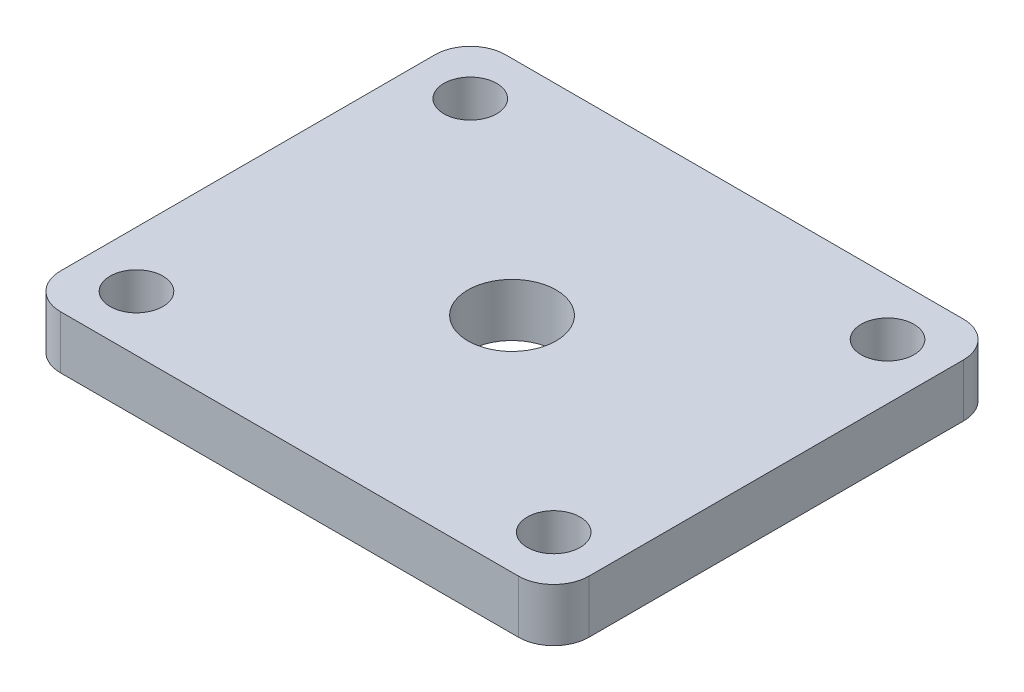
from build123d import *

# Parameters (mm, degrees)
SKETCH2_W           = 38
SKETCH2_H           = 32
SKETCH2_R           = 3.175
SKETCH2_R_2         = 1.89865
BOSS_EXTRUDE1_DEPTH = 3.81
FILLET1_R           = 2.54


with BuildPart() as part:
    # Sketch2 → Boss-Extrude1 (new body)
    with BuildSketch(Plane(origin=(0, 0, 0), x_dir=(1, 0, 0), z_dir=(0, 1, 0))):
        with Locations((19, 16)):
            Rectangle(SKETCH2_W, SKETCH2_H)
        with Locations(Location((19, 16, 0), (0, 0, 90))):
            Circle(SKETCH2_R, mode=Mode.SUBTRACT)
        with Locations(Location((4, 4, 0), (0, 0, 90))):
            Circle(SKETCH2_R_2, mode=Mode.SUBTRACT)
        with Locations(Location((4, 28, 0), (0, 0, 90))):
            Circle(SKETCH2_R_2, mode=Mode.SUBTRACT)
        with Locations(Location((34, 28, 0), (0, 0, 90))):
            Circle(SKETCH2_R_2, mode=Mode.SUBTRACT)
        with Locations(Location((34, 4, 0), (0, 0, 90))):
            Circle(SKETCH2_R_2, mode=Mode.SUBTRACT)
    extrude(amount=BOSS_EXTRUDE1_DEPTH)

    # Fillet1
    fillet1_edges = [part.edges().sort_by_distance(p)[0] for p in [
        (0, 1.905, -32),
        (38, 1.905, -32),
        (38, 1.905, 0),
        (0, 1.905, 0),
    ]]
    fillet(fillet1_edges, radius=FILLET1_R)


solid = part.part
